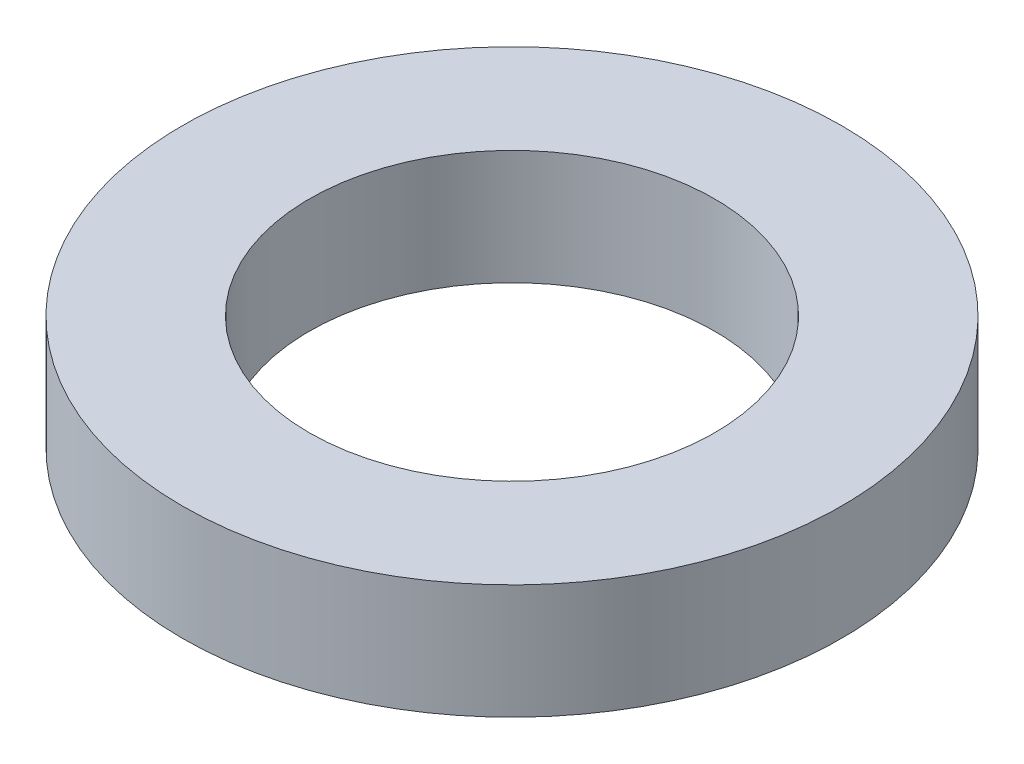
from build123d import *

# Parameters (mm, degrees)
SKETCH1_R           = 2.0447
BOSS_EXTRUDE1_DEPTH = 0.7112
SKETCH5_R           = 1.2573
CUT_EXTRUDE1_DEPTH  = 3.977818265


with BuildPart() as part:
    # Sketch1 → Boss-Extrude1 (new body)
    with BuildSketch(Plane(origin=(0, 0, 0), x_dir=(1, 0, 0), z_dir=(0, 1, 0))):
        with Locations(Location((0, 0, 0), (0, 0, 270))):
            Circle(SKETCH1_R)
    extrude(amount=BOSS_EXTRUDE1_DEPTH)

    # Sketch5 → Cut-Extrude1 (cut, through all)
    with BuildSketch(Plane(origin=(0, 0.7112, 0), x_dir=(-1, 0, 0), z_dir=(0, 1, 0))):
        with Locations(Location((0, 0, 0), (0, 0, 90))):
            Circle(SKETCH5_R)
    extrude(amount=-CUT_EXTRUDE1_DEPTH, mode=Mode.SUBTRACT)


solid = part.part
